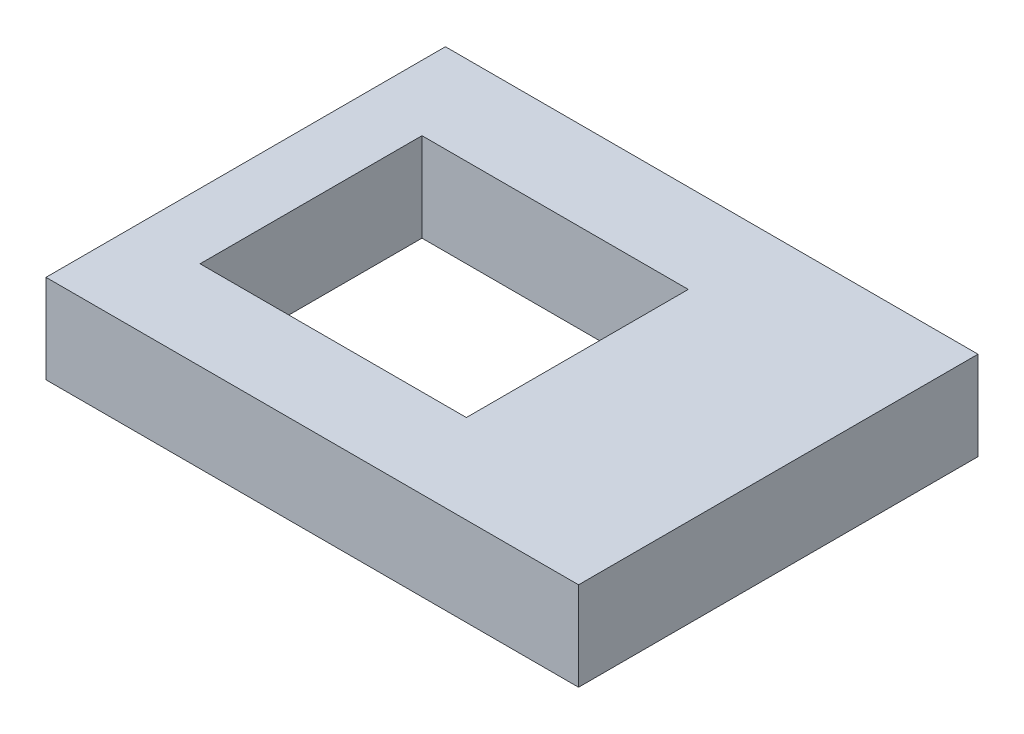
from build123d import *

# Parameters (mm, degrees)
SKETCH1_W           = 152.4
SKETCH1_H           = 114.3
BOSS_EXTRUDE1_DEPTH = 25.4
SKETCH2_W           = 76.2
SKETCH2_H           = 63.5
CUT_EXTRUDE1_DEPTH  = 99.578509321


with BuildPart() as part:
    # Sketch1 → Boss-Extrude1 (new body)
    with BuildSketch(Plane(origin=(0, 0, 0), x_dir=(1, 0, 0), z_dir=(0, 1, 0))):
        Rectangle(SKETCH1_W, SKETCH1_H)
    extrude(amount=BOSS_EXTRUDE1_DEPTH)

    # Sketch2 → Cut-Extrude1 (cut, through all)
    with BuildSketch(Plane(origin=(0, 25.4, 0), x_dir=(1, 0, 0), z_dir=(0, 1, 0))):
        with Locations((-19.407094153, 0)):
            Rectangle(SKETCH2_W, SKETCH2_H)
    extrude(amount=-CUT_EXTRUDE1_DEPTH, mode=Mode.SUBTRACT)


solid = part.part
